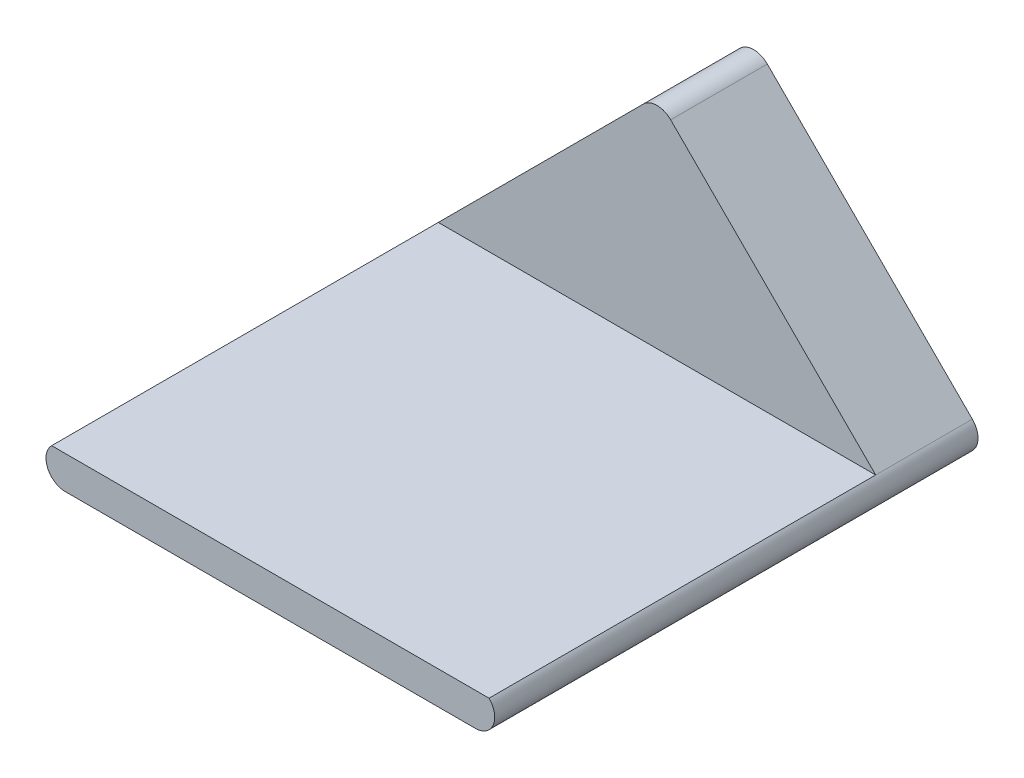
from build123d import *

# Parameters (mm, degrees)
BOSS_EXTRU_1_DEPTH = 50
BOSS_EXTRU_2_DEPTH = 10


with BuildPart() as part:
    # Esquisse1 → Boss.-Extru.1 (new body)
    with BuildSketch(Plane.XY):
        with BuildLine():
            Line((48.669047558, 3.414213562), (3.414213562, 3.414213562))
            ThreePointArc((3.414213562, 3.414213562), (2.98066806, 1.234633135), (4.828427125, 0))
            Line((4.828427125, 0), (47.254833996, 0))
            ThreePointArc((47.254833996, 0), (49.102593061, 1.234633135), (48.669047558, 3.414213562))
        make_face()
    extrude(amount=BOSS_EXTRU_1_DEPTH)

    # Esquisse1<3> → Boss.-Extru.2 (add)
    with BuildSketch(Plane.XY):
        with BuildLine():
            Line((24.627416998, 24.627416998), (3.414213562, 3.414213562))
            Line((3.414213562, 3.414213562), (48.669047558, 3.414213562))
            Line((48.669047558, 3.414213562), (27.455844123, 24.627416998))
            ThreePointArc((27.455844123, 24.627416998), (26.04163056, 25.213203436), (24.627416998, 24.627416998))
        make_face()
    extrude(amount=BOSS_EXTRU_2_DEPTH)


solid = part.part
